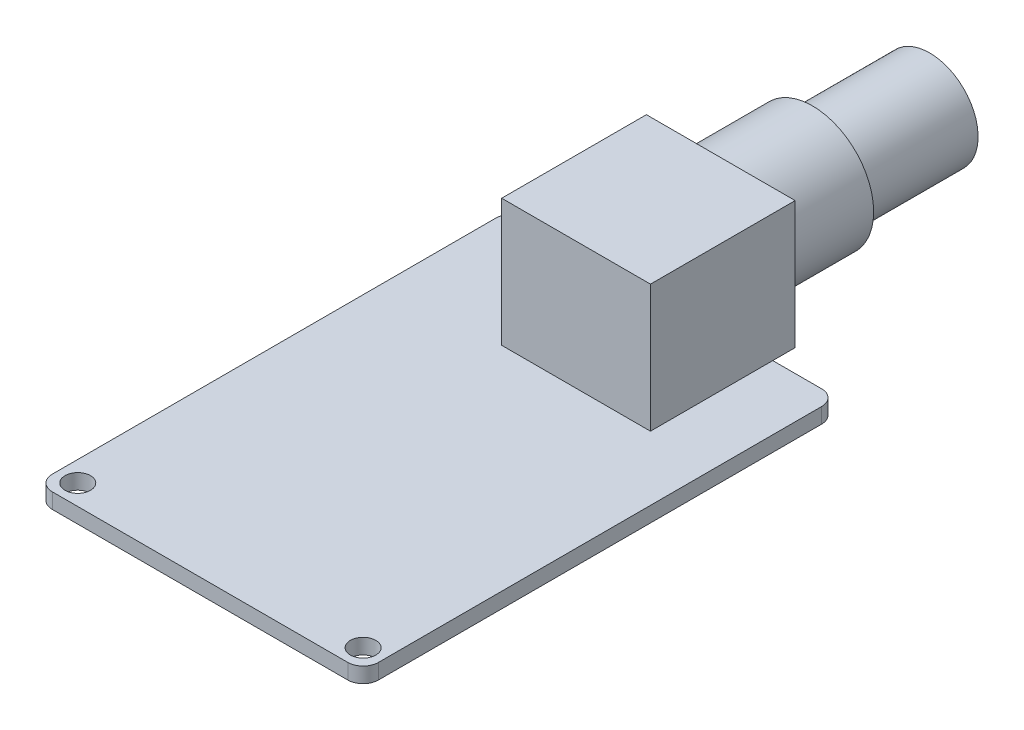
from build123d import *

# Parameters (mm, degrees)
EXTRUDE_1_DEPTH      = 3.5
EXTRUDE_1_DEPTH_BACK = 5.5
SKETCH_1_R           = 6
SKETCH_2_R           = 4.75
EXTRUDE_2_DEPTH      = 11.5
SKETCH_3_R           = 4.25
CUT_EXTRUDE_1_DEPTH  = 11.5
SKETCH_4_W           = 14.6
SKETCH_4_H           = 12.5
EXTRUDE_3_DEPTH      = 14.2
SKETCH_5_R           = 1.25
EXTRUDE_4_DEPTH      = 1.5


with BuildPart() as part:
    # 草圖1 → 填料-伸長1 (new, two sides: drawn at the far end of the back side and taken through both)
    with BuildSketch(Plane.XY.offset(-EXTRUDE_1_DEPTH_BACK)):
        with Locations((-29.340909091, 31.5)):
            Circle(SKETCH_1_R)
    extrude(amount=EXTRUDE_1_DEPTH + EXTRUDE_1_DEPTH_BACK)

    # 草圖2 → 填料-伸長2 (add)
    with BuildSketch(Plane(origin=(0, 0, -5.5), x_dir=(-1, 0, 0), z_dir=(0, 0, -1))):
        with Locations((29.340909091, 31.5)):
            Circle(SKETCH_2_R)
    extrude(amount=EXTRUDE_2_DEPTH)

    # 草圖3 → 除料-伸長1 (cut)
    with BuildSketch(Plane(origin=(0, 0, -17), x_dir=(-1, 0, 0), z_dir=(0, 0, -1))):
        with Locations((29.340909091, 31.5)):
            Circle(SKETCH_3_R)
    extrude(amount=-CUT_EXTRUDE_1_DEPTH, mode=Mode.SUBTRACT)

    # 草圖4 → 填料-伸長3 (add)
    with BuildSketch(Plane.XY.offset(3.5)):
        with Locations((-29.340909091, 31.35)):
            Rectangle(SKETCH_4_W, SKETCH_4_H)
    extrude(amount=EXTRUDE_3_DEPTH)

    # 草圖5 → 填料-伸長4 (add)
    with BuildSketch(Plane.XZ.offset(-25.1)):
        with BuildLine():
            Line((-17.240909091, 5.697422491), (-46.240909091, 5.697422491))
            ThreePointArc((-46.240909091, 5.697422491), (-47.301569263, 6.136762319), (-47.740909091, 7.197422491))
            Line((-47.740909091, 7.197422491), (-47.740909091, 50.697422491))
            ThreePointArc((-47.740909091, 50.697422491), (-47.301569263, 51.758082663), (-46.240909091, 52.197422491))
            Line((-46.240909091, 52.197422491), (-17.240909091, 52.197422491))
            ThreePointArc((-17.240909091, 52.197422491), (-16.180248919, 51.758082663), (-15.740909091, 50.697422491))
            Line((-15.740909091, 50.697422491), (-15.740909091, 7.197422491))
            ThreePointArc((-15.740909091, 7.197422491), (-16.180248919, 6.136762319), (-17.240909091, 5.697422491))
        make_face()
        with Locations(Location((-17.740909091, 50.197422491, 0), (0, 0, 270))):
            Circle(SKETCH_5_R, mode=Mode.SUBTRACT)
        with Locations(Location((-45.740909091, 50.197422491, 0), (0, 0, 270))):
            Circle(SKETCH_5_R, mode=Mode.SUBTRACT)
    extrude(amount=EXTRUDE_4_DEPTH)


solid = part.part
